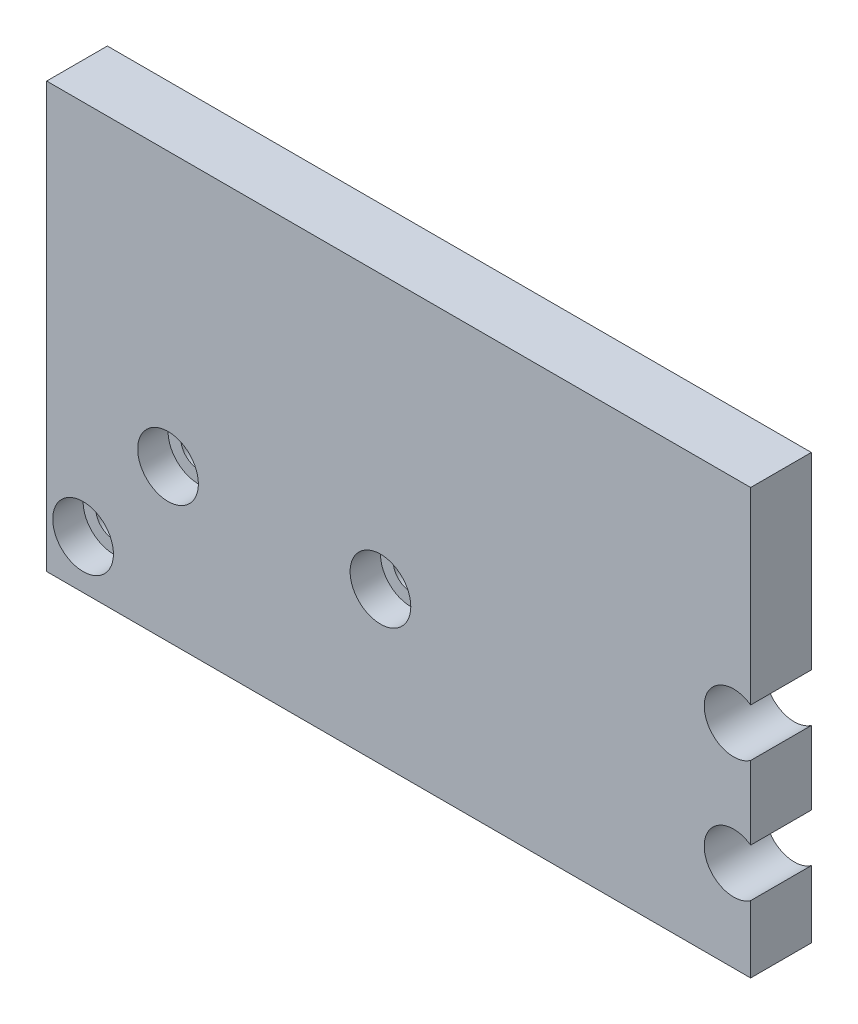
from build123d import *

# Parameters (mm, degrees)
SKETCH_1_W                   = 116
SKETCH_1_H                   = 70
EXTRUDE_1_DEPTH              = 10
SKETCH_2_R                   = 4.85
CUT_EXTRUDE_1_DEPTH          = 136.852861582
HOLE_WIZARD_M5_1_D           = 5.8
HOLE_WIZARD_M5_1_CBORE_D     = 10
HOLE_WIZARD_M5_1_CBORE_DEPTH = 5


with BuildPart() as part:
    # 草图1 → 凸台-拉伸1 (new body)
    with BuildSketch(Plane.XY):
        with Locations((58, 35)):
            Rectangle(SKETCH_1_W, SKETCH_1_H)
    extrude(amount=EXTRUDE_1_DEPTH)

    # 草图2 → 切除-拉伸1 (cut, through all)
    with BuildSketch(Plane.XY.offset(10)):
        with Locations((113.2, 35)):
            Circle(SKETCH_2_R)
        with Locations((113.2, 15)):
            Circle(SKETCH_2_R)
    extrude(amount=-CUT_EXTRUDE_1_DEPTH, mode=Mode.SUBTRACT)

    # M5 六角凹头螺钉的柱形沉头孔1 (through all)
    with Locations(Plane.XY.offset(10)):
        with Locations((6, 8), (20, 25), (55, 25)):
            CounterBoreHole(HOLE_WIZARD_M5_1_D / 2, HOLE_WIZARD_M5_1_CBORE_D / 2, HOLE_WIZARD_M5_1_CBORE_DEPTH)


solid = part.part
